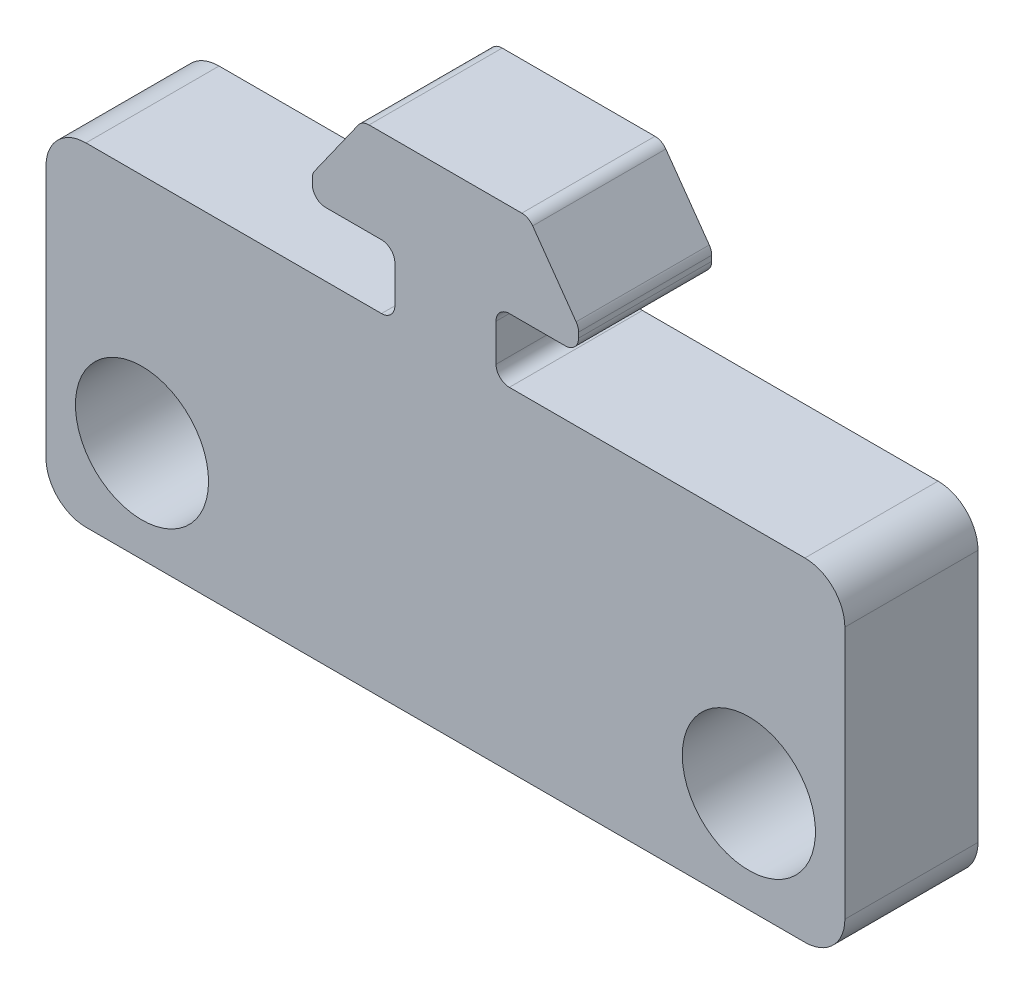
from build123d import *

# Parameters (mm, degrees)
BOSS_EXTRUDE1_DEPTH = 10
BOSS_EXTRUDE2_DEPTH = 10
SKETCH5_R           = 5
CUT_EXTRUDE1_DEPTH  = 44.45158225
FILLET1_R           = 1
FILLET2_R           = 1
FILLET3_R           = 3


with BuildPart() as part:
    # Sketch2 → Boss-Extrude1 (new body)
    with BuildSketch(Plane.XY):
        Polygon((-10, 0), (0, 0), (0, 7), (-6.25480432, 7), (-10, 1.709943763), align=None)
        Polygon((0, 0), (10, 0), (10, 1.709943763), (6.25480432, 7), (0, 7), align=None)
    extrude(amount=BOSS_EXTRUDE1_DEPTH)

    # Sketch4 → Boss-Extrude2 (add)
    with BuildSketch(Plane.XY):
        Polygon((0, 0), (-3.8, 0), (-3.8, -4.8), (-30, -4.8), (-30, -29.8), (0, -29.8), align=None)
        Polygon((3.8, 0), (0, 0), (0, -29.8), (30, -29.8), (30, -4.8), (3.8, -4.8), align=None)
    extrude(amount=BOSS_EXTRUDE2_DEPTH)

    # Sketch5 → Cut-Extrude1 (cut, through all)
    with BuildSketch(Plane.XY):
        with Locations((-22.790976064, -22.227391232)):
            Circle(SKETCH5_R)
        with Locations(Location((22.790976064, -22.227391232, 0), (0, 0, 180))):
            Circle(SKETCH5_R)
    extrude(amount=CUT_EXTRUDE1_DEPTH, mode=Mode.SUBTRACT)

    # Fillet1
    fillet1_edges = [part.edges().sort_by_distance(p)[0] for p in [
        (-10, 0, 5),
        (-10, 1.709943763, 5),
        (-6.25480432, 7, 5),
        (6.25480432, 7, 5),
        (10, 1.709943763, 5),
        (10, 0, 5),
    ]]
    fillet(fillet1_edges, radius=FILLET1_R)

    # Fillet2
    fillet2_edges = [part.edges().sort_by_distance(p)[0] for p in [
        (3.8, -4.8, 5),
        (3.8, 0, 5),
        (-3.8, 0, 5),
        (-3.8, -4.8, 5),
    ]]
    fillet(fillet2_edges, radius=FILLET2_R)

    # Fillet3
    fillet3_edges = [part.edges().sort_by_distance(p)[0] for p in [
        (-30, -29.8, 5),
        (30, -29.8, 5),
        (30, -4.8, 5),
        (-30, -4.8, 5),
    ]]
    fillet(fillet3_edges, radius=FILLET3_R)


solid = part.part
